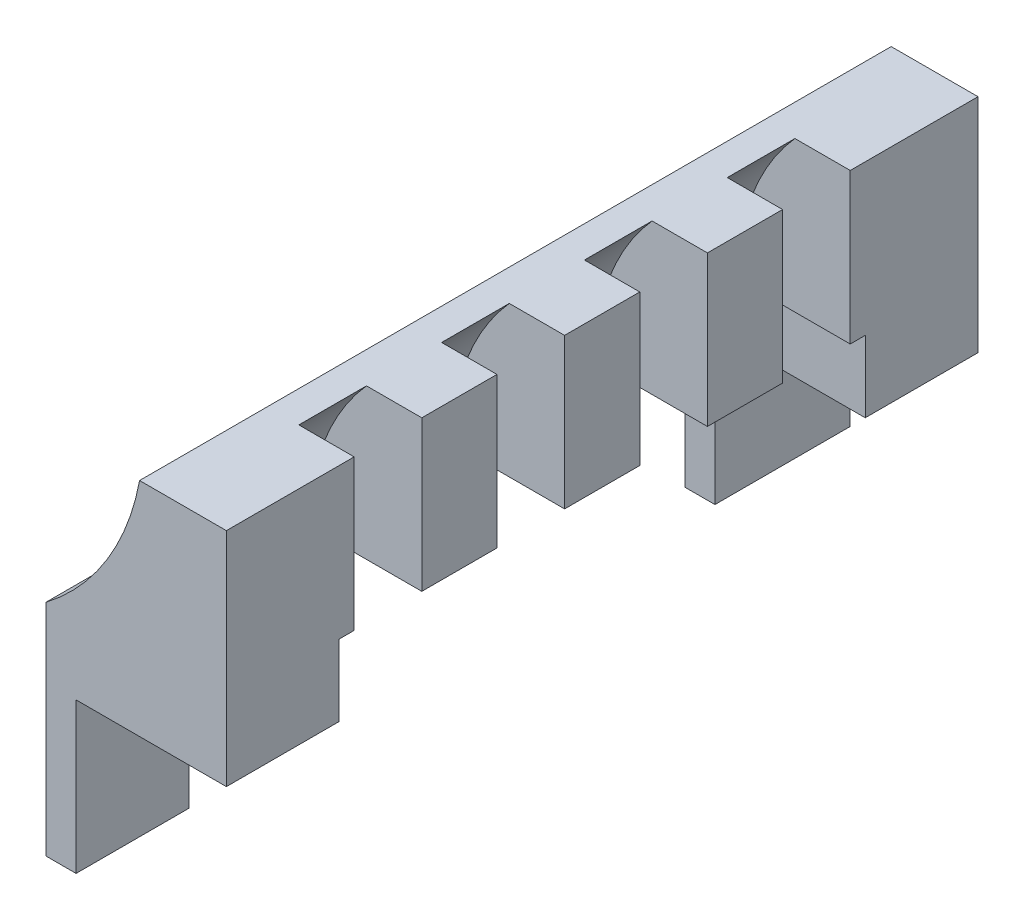
from build123d import *

# Parameters (mm, degrees)
BOSS_EXTRUDE1_DEPTH      = 50
BOSS_EXTRUDE1_DEPTH_BACK = 50
CUT_EXTRUDE1_DEPTH       = 66.448930473
CUT_EXTRUDE1_DEPTH_BACK  = 66.448930473
SKETCH2_W                = 70
SKETCH2_H                = 29.5
SKETCH5_W                = 15
SKETCH5_H                = 9
CUT_EXTRUDE2_DEPTH       = 20
BOSS_EXTRUDE3_REACH      = 110.128
BOSS_EXTRUDE4_DEPTH      = 3


with BuildPart() as part:
    # Sketch1 → Boss-Extrude1 (new, two sides: drawn at the far end of the back side and taken through both)
    with BuildSketch(Plane.XY.offset(-BOSS_EXTRUDE1_DEPTH_BACK)):
        with BuildLine():
            Line((-2, -14.75), (2, -14.75))
            Line((2, -14.75), (2, 5.25))
            Line((2, 5.25), (22, 5.25))
            Line((22, 5.25), (22, 14.75))
            Line((22, 14.75), (22, 34.75))
            Line((22, 34.75), (10.449961479, 34.75))
            ThreePointArc((10.449961479, 34.75), (6.111442266, 23.465706156), (-2, 14.501190503))
            Line((-2, 14.501190503), (-2, -14.75))
        make_face()
    extrude(amount=BOSS_EXTRUDE1_DEPTH + BOSS_EXTRUDE1_DEPTH_BACK)

    # Sketch2 → Cut-Extrude1 (cut, two sides: drawn at the far end of the back side and taken through both)
    with BuildSketch(Plane(origin=(-2, 0, 0), x_dir=(0, 0, -1), z_dir=(1, 0, 0)).offset(-CUT_EXTRUDE1_DEPTH_BACK)):
        Rectangle(SKETCH2_W, SKETCH2_H)
    extrude(amount=CUT_EXTRUDE1_DEPTH + CUT_EXTRUDE1_DEPTH_BACK, mode=Mode.SUBTRACT)

    # Sketch5 → Cut-Extrude2 (cut)
    with BuildSketch(Plane(origin=(0, 34.75, 0), x_dir=(1, 0, 0), z_dir=(0, 1, 0))):
        with Locations((14.5, -28.5)):
            Rectangle(SKETCH5_W, SKETCH5_H)
        with Locations((14.5, -9.5)):
            Rectangle(SKETCH5_W, SKETCH5_H)
        with Locations((14.5, 9.5)):
            Rectangle(SKETCH5_W, SKETCH5_H)
        with Locations((14.5, 28.5)):
            Rectangle(SKETCH5_W, SKETCH5_H)
    extrude(amount=-CUT_EXTRUDE2_DEPTH, mode=Mode.SUBTRACT)

    # Boss-Extrude3: up to this face of the body (flat: up to its plane)
    boss_extrude3_end = Plane(part.part.faces().sort_by_distance((10.585369563, 14.996232635, -50))[0])
    # Sketch6 → Boss-Extrude3 (add, up to the picked face)
    with BuildSketch(Plane.XY.offset(50), mode=Mode.PRIVATE) as boss_extrude3_sk1:
        with BuildLine():
            Line((14.639320225, 34.75), (10.449961479, 34.75))
            ThreePointArc((10.449961479, 34.75), (9.109168973, 29.740022443), (7, 25.001984252))
            Line((7, 25.001984252), (7, 14.75))
            ThreePointArc((7, 14.75), (8.974829231, 25.454662693), (14.639320225, 34.75))
        make_face()
    boss_extrude3_tool1 = split(extrude(boss_extrude3_sk1.sketch, amount=-BOSS_EXTRUDE3_REACH, mode=Mode.PRIVATE), bisect_by=boss_extrude3_end, keep=Keep.BOTH, mode=Mode.PRIVATE)
    add(boss_extrude3_tool1.solids().sort_by(Axis((9.906803, 28.936431, 50), (0, 0, -1)))[0])

    # Sketch8 → Boss-Extrude4 (add)
    with BuildSketch(Plane(origin=(0, 0, -50), x_dir=(-1, 0, 0), z_dir=(0, 0, -1))):
        Polygon((-12, 0.25), (-2, 0.25), (-2, -14.75), (2, -14.75), (2, 14.501190503), (-12, 14.501190503), align=None)
    extrude(amount=BOSS_EXTRUDE4_DEPTH)


solid = part.part
